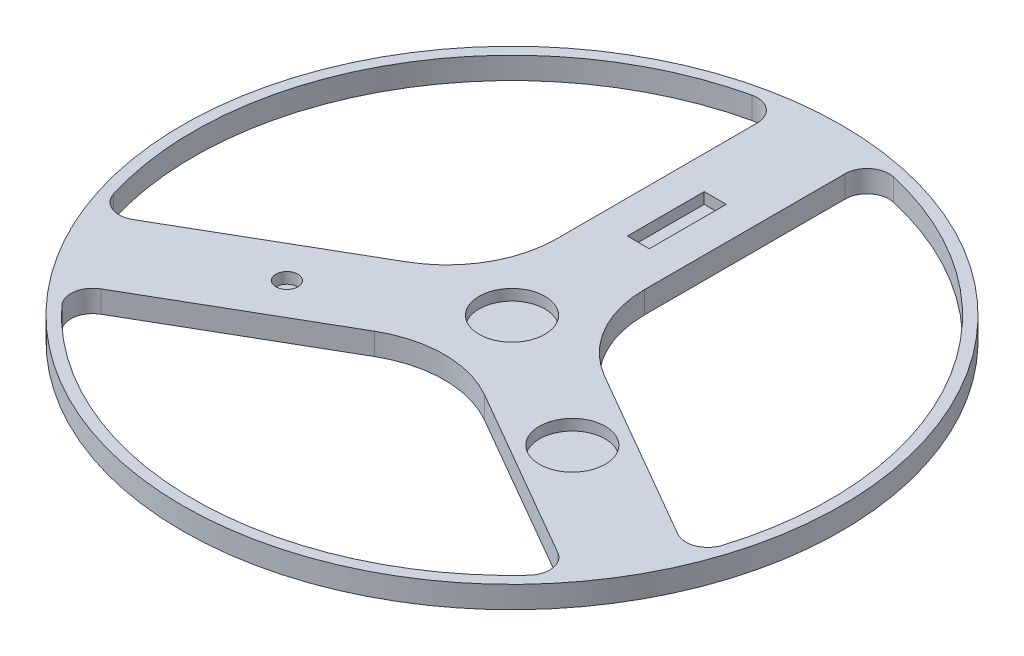
from build123d import *

# Parameters (mm, degrees)
SKETCH1_R           = 30
BOSS_EXTRUDE1_DEPTH = 2
FILLET1_R           = 10
FILLET2_R           = 2
SKETCH2_R           = 3
CUT_EXTRUDE1_DEPTH  = 1
SKETCH3_R           = 1
SKETCH3_R_2         = 3
SKETCH3_W           = 2
SKETCH3_H           = 7
CUT_EXTRUDE2_DEPTH  = 1


with BuildPart() as part:
    # Sketch1 → Boss-Extrude1 (new body)
    with BuildSketch(Plane(origin=(0, 0, 0), x_dir=(1, 0, 0), z_dir=(0, 1, 0))):
        with Locations(Location((0, 0, 0), (0, 0, 270))):
            Circle(SKETCH1_R)
        with BuildLine():
            Line((-22.874685928, -17.825508231), (0, -4.618802154))
            Line((0, -4.618802154), (22.874685928, -17.825508231))
            ThreePointArc((22.874685928, -17.825508231), (0, -29), (-22.874685928, -17.825508231))
        make_face(mode=Mode.SUBTRACT)
        with BuildLine():
            Line((26.874685928, -10.897305001), (4, 2.309401077))
            Line((4, 2.309401077), (4, 28.722813233))
            ThreePointArc((4, 28.722813233), (25.11473671, 14.5), (26.874685928, -10.897305001))
        make_face(mode=Mode.SUBTRACT)
        with BuildLine():
            Line((-4, 28.722813233), (-4, 2.309401077))
            Line((-4, 2.309401077), (-26.874685928, -10.897305001))
            ThreePointArc((-26.874685928, -10.897305001), (-25.11473671, 14.5), (-4, 28.722813233))
        make_face(mode=Mode.SUBTRACT)
    extrude(amount=BOSS_EXTRUDE1_DEPTH)

    # Fillet1
    fillet1_edges = [part.edges().sort_by_distance(p)[0] for p in [
        (0, 1, 4.618802154),
        (-4, 1, -2.309401077),
        (4, 1, -2.309401077),
    ]]
    fillet(fillet1_edges, radius=FILLET1_R)

    # Fillet2
    fillet2_edges = [part.edges().sort_by_distance(p)[0] for p in [
        (-22.874685928, 1, 17.825508231),
        (22.874685928, 1, 17.825508231),
        (-4, 1, -28.722813233),
        (-26.874685928, 1, 10.897305001),
        (26.874685928, 1, 10.897305001),
        (4, 1, -28.722813233),
    ]]
    fillet(fillet2_edges, radius=FILLET2_R)

    # Sketch2 → Cut-Extrude1 (cut)
    with BuildSketch(Plane(origin=(0, 2, 0), x_dir=(1, 0, 0), z_dir=(0, 1, 0))):
        with Locations(Location((0, 0, 0), (0, 0, 270))):
            Circle(SKETCH2_R)
    extrude(amount=-CUT_EXTRUDE1_DEPTH, mode=Mode.SUBTRACT)

    # Sketch3 → Cut-Extrude2 (cut)
    with BuildSketch(Plane(origin=(0, 2, 0), x_dir=(1, 0, 0), z_dir=(0, 1, 0))):
        with Locations(Location((-12.990200407, -7.500312817, 0), (0, 0, 270))):
            Circle(SKETCH3_R)
        with Locations(Location((12.990019825, -7.499374327, 0), (0, 0, 270))):
            Circle(SKETCH3_R_2)
        with Locations((-0.000361232, 15.000625673)):
            Rectangle(SKETCH3_W, SKETCH3_H)
    extrude(amount=-CUT_EXTRUDE2_DEPTH, mode=Mode.SUBTRACT)


solid = part.part
